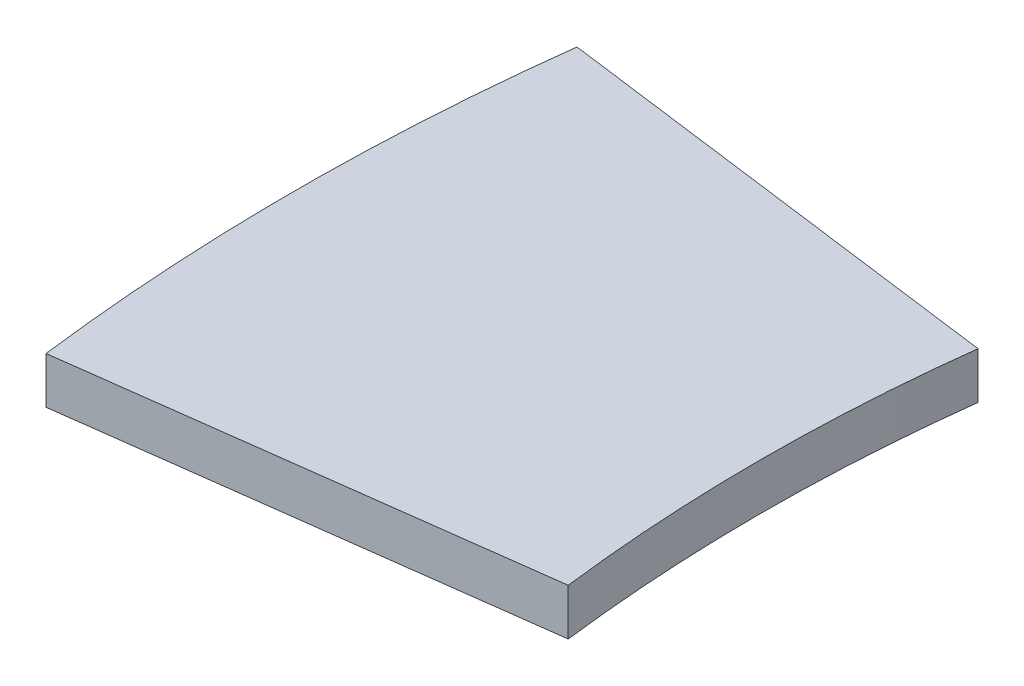
from build123d import *

# Parameters (mm, degrees)
BOSS_EXTRUDE1_DEPTH = 5


with BuildPart() as part:
    # Sketch1 → Boss-Extrude1 (new, symmetric)
    with BuildSketch(Plane(origin=(0, 0, 0), x_dir=(1, 0, 0), z_dir=(0, 1, 0))):
        with BuildLine():
            Line((-47.98144063, 57.143584296), (51.165786695, 44.090604189))
            ThreePointArc((51.165786695, 44.090604189), (48.468301866, 0.102962144), (51.165786695, -43.884679901))
            Line((51.165786695, -43.884679901), (-47.991586105, -56.856415253))
            ThreePointArc((-47.991586105, -56.856415253), (-51.531696313, 0.143900026), (-47.98144063, 57.143584296))
        make_face()
    extrude(amount=BOSS_EXTRUDE1_DEPTH, both=True)


solid = part.part
